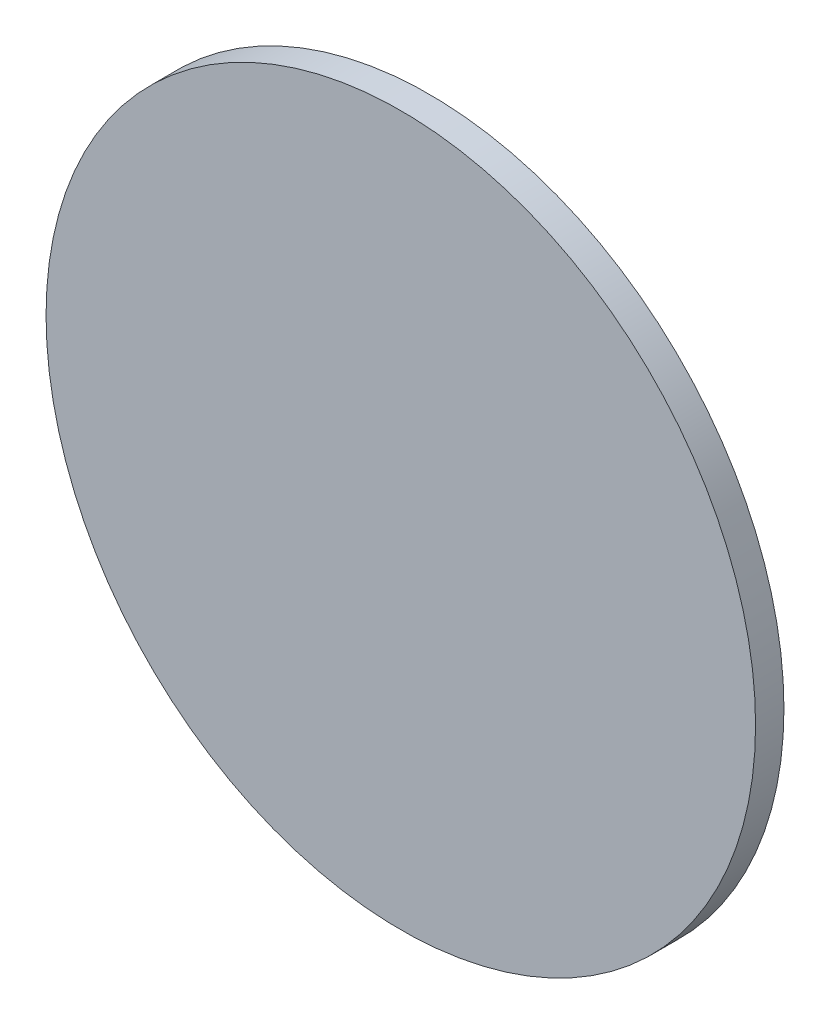
from build123d import *

# Parameters (mm, degrees)
SKETCH_1_R      = 12.5
EXTRUDE_1_DEPTH = 0.5


with BuildPart() as part:
    # ｽｹｯﾁ1 → ﾎﾞｽ - 押し出し1 (new, symmetric)
    with BuildSketch(Plane.XY):
        Circle(SKETCH_1_R)
    extrude(amount=EXTRUDE_1_DEPTH, both=True)


solid = part.part
